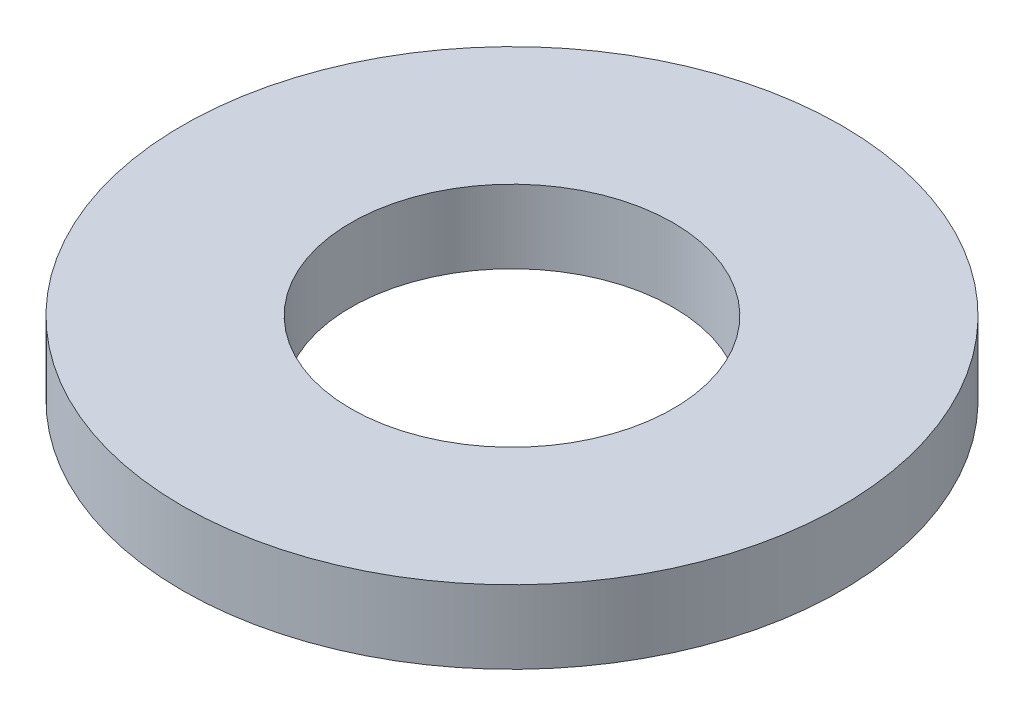
from build123d import *

# Parameters (mm, degrees)
SKETCH_1_R      = 4.5
SKETCH_1_R_2    = 2.2
EXTRUDE_1_DEPTH = 1


with BuildPart() as part:
    # 草图1 → 凸台-拉伸1 (new body)
    with BuildSketch(Plane(origin=(0, 0, 0), x_dir=(1, 0, 0), z_dir=(0, 1, 0))):
        with Locations(Location((0, 0, 0), (0, 0, 270))):
            Circle(SKETCH_1_R)
        with Locations(Location((0, 0, 0), (0, 0, 270))):
            Circle(SKETCH_1_R_2, mode=Mode.SUBTRACT)
    extrude(amount=EXTRUDE_1_DEPTH)


solid = part.part
